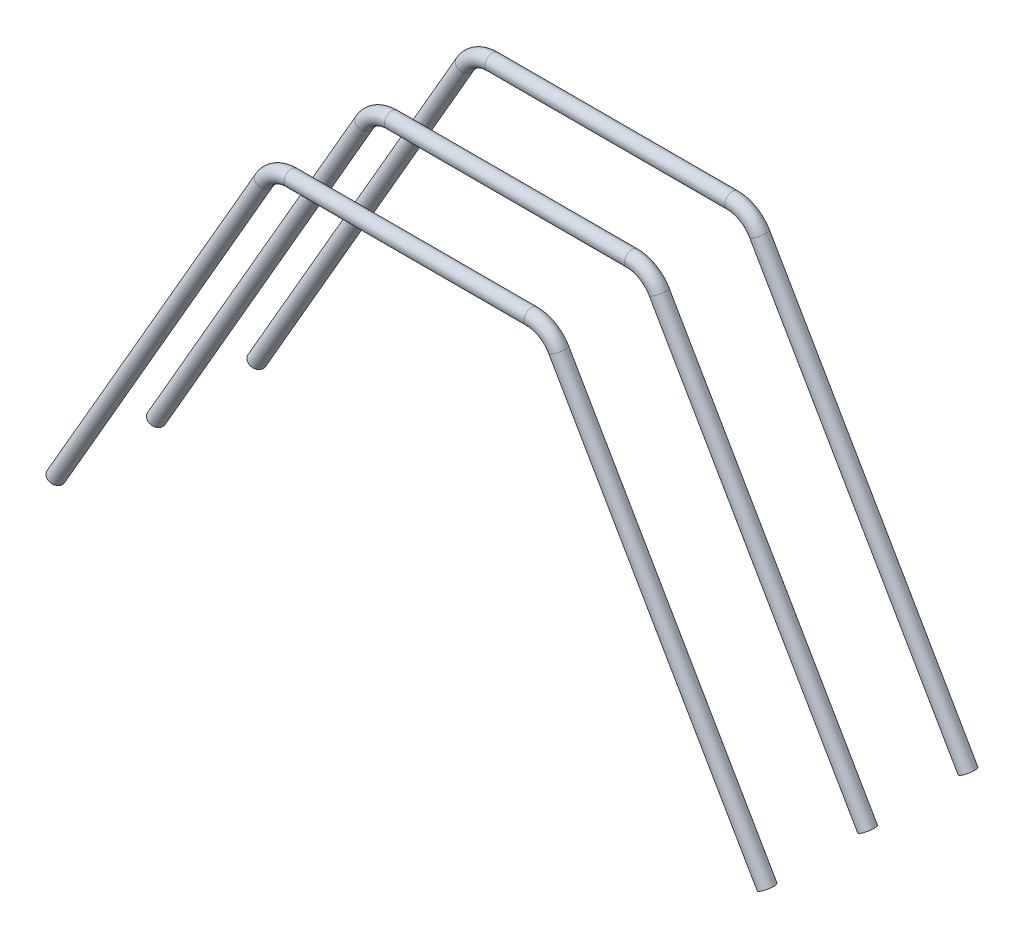
from build123d import *

# Parameters (mm, degrees)
SKETCH_2_R             = 6
PATTERN_LINEAR_1_COUNT = 2
PATTERN_LINEAR_1_PITCH = 80


with BuildPart() as part:
    # По траектории1: sweep along a path in Эскиз3
    with BuildLine(Plane.XY) as sweep_1_path:
        Line((0, -22), (95.56624327, -22))
        ThreePointArc((95.56624327, -22), (108.06624327, -25.349364905), (117.216878365, -34.5))
        Line((117.216878365, -34.5), (283.205080757, -322))
    # Эскиз2 → По траектории1 (sweep)
    with BuildSketch(Plane(origin=(0, 0, 0), x_dir=(0, 0, -1), z_dir=(1, 0, 0))):
        with Locations((0, -22)):
            Circle(SKETCH_2_R)
    sweep_1 = sweep(path=sweep_1_path.line)

    # Зеркальное отражение1: По траектории1 across plane
    add(sweep_1.mirror(Plane(origin=(0, -22, 0), x_dir=(0, 0, 1), z_dir=(1, 0, 0))))


with BuildPart() as pattern_linear_1_1:
    # Линейный массив1: pattern copy
    add(part.part.moved(Location(Vector(0, 0, -1) * (1 * PATTERN_LINEAR_1_PITCH))))


with BuildPart() as body_3:
    # Зеркальное отражение2: mirrored copy
    add(pattern_linear_1_1.part.mirror(Plane.XY))


solid = Compound([part.part, pattern_linear_1_1.part, body_3.part])
